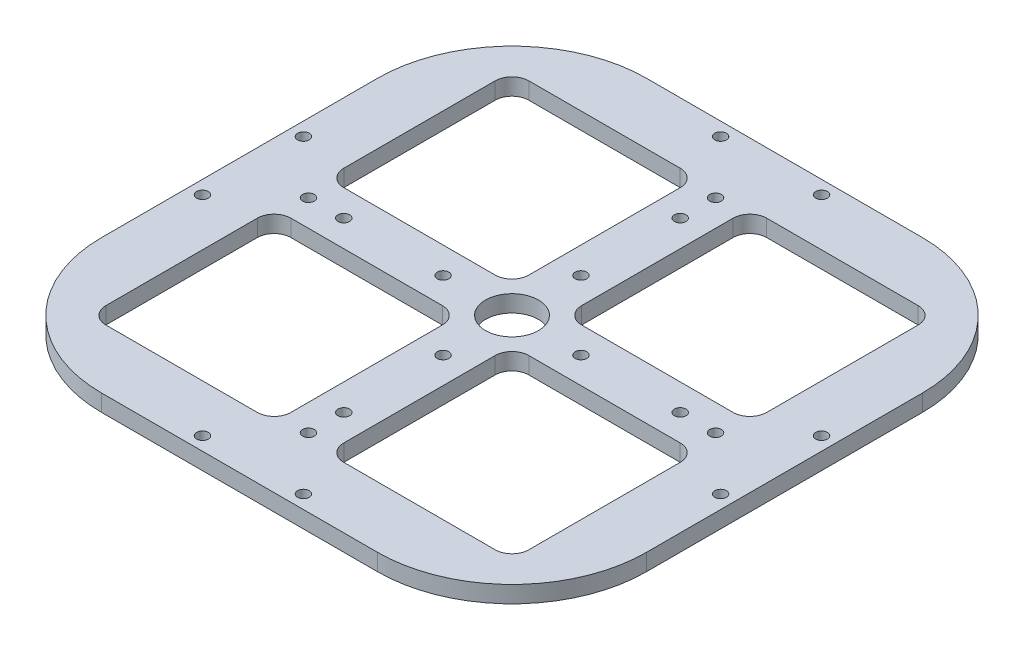
from build123d import *

# Parameters (mm, degrees)
SKETCH1_W                = 205.74
SKETCH1_H                = 205.74
SKETCH1_R                = 2.200000045
BOSS_EXTRUDE1_DEPTH      = 6.35
SKETCH3_R                = 9.999999939
CUT_EXTRUDE2_DEPTH       = 146.618667416
SKETCH4_W                = 69.85
SKETCH4_H                = 69.85
CUT_EXTRUDE3_DEPTH       = 146.618667416
FILLET1_R                = 6.35
CIRPATTERN2_COUNT        = 4
FILLET1_OF_CIRPATTERN2_R = 6.35
FILLET2_R                = 50.8
SKETCH10_R               = 2.200000045
CUT_EXTRUDE6_DEPTH       = 146.618667416
SKETCH11_R               = 4.000000001
CUT_EXTRUDE7_DEPTH       = 3.000000096
CIRPATTERN4_COUNT        = 4


with BuildPart() as part:
    # Sketch1 → Boss-Extrude1 (new body)
    with BuildSketch(Plane(origin=(0, 0, 0), x_dir=(1, 0, 0), z_dir=(0, 1, 0))):
        Rectangle(SKETCH1_W, SKETCH1_H)
        with Locations(Location((63.5, 0, 0), (0, 0, 270))):
            Circle(SKETCH1_R, mode=Mode.SUBTRACT)
        with Locations(Location((0, -63.5, 0), (0, 0, 270))):
            Circle(SKETCH1_R, mode=Mode.SUBTRACT)
        with Locations(Location((-63.5, 0, 0), (0, 0, 270))):
            Circle(SKETCH1_R, mode=Mode.SUBTRACT)
        with Locations(Location((0, 63.5, 0), (0, 0, 270))):
            Circle(SKETCH1_R, mode=Mode.SUBTRACT)
    extrude(amount=BOSS_EXTRUDE1_DEPTH)

    # Sketch3 → Cut-Extrude2 (cut, through all)
    with BuildSketch(Plane(origin=(0, 6.35, 0), x_dir=(1, 0, 0), z_dir=(0, 1, 0))):
        with Locations(Location((0, 0, 0), (0, 0, 270))):
            Circle(SKETCH3_R)
    extrude(amount=-CUT_EXTRUDE2_DEPTH, mode=Mode.SUBTRACT)

    # Sketch4 → Cut-Extrude3 (cut, through all)
    with BuildSketch(Plane(origin=(0, 6.35, 0), x_dir=(1, 0, 0), z_dir=(0, 1, 0))):
        with Locations((-44.901280605, 44.901280605)):
            Rectangle(SKETCH4_W, SKETCH4_H)
    cut_extrude3 = extrude(amount=-CUT_EXTRUDE3_DEPTH, mode=Mode.SUBTRACT)

    # Fillet1
    fillet1_edges = [part.edges().sort_by_distance(p)[0] for p in [
        (-9.976280605, 3.175, -79.826280605),
        (-9.976280605, 3.175, -9.976280605),
        (-79.826280605, 3.175, -9.976280605),
        (-79.826280605, 3.175, -79.826280605),
    ]]
    fillet(fillet1_edges, radius=FILLET1_R)

    # CirPattern2: Cut-Extrude3 ×4 about axis
    cirpattern2_axis = Axis((0, 0, 0), (0, 1, 0))
    for i in range(1, CIRPATTERN2_COUNT):
        add(cut_extrude3.rotate(cirpattern2_axis, i * 360 / CIRPATTERN2_COUNT), mode=Mode.SUBTRACT)

    # Fillet1 of CirPattern2
    fillet1_of_cirpattern2_edges = [part.edges().sort_by_distance(p)[0] for p in [
        (-79.826280605, 3.175, 9.976280605),
        (-9.976280605, 3.175, 9.976280605),
        (-9.976280605, 3.175, 79.826280605),
        (-79.826280605, 3.175, 79.826280605),
        (9.976280605, 3.175, 79.826280605),
        (9.976280605, 3.175, 9.976280605),
        (79.826280605, 3.175, 9.976280605),
        (79.826280605, 3.175, 79.826280605),
        (79.826280605, 3.175, -9.976280605),
        (9.976280605, 3.175, -9.976280605),
        (9.976280605, 3.175, -79.826280605),
        (79.826280605, 3.175, -79.826280605),
    ]]
    fillet(fillet1_of_cirpattern2_edges, radius=FILLET1_OF_CIRPATTERN2_R)

    # Fillet2
    fillet2_edges = [part.edges().sort_by_distance(p)[0] for p in [
        (102.87, 3.175, 102.87),
        (-102.87, 3.175, 102.87),
        (-102.87, 3.175, -102.87),
        (102.87, 3.175, -102.87),
    ]]
    fillet(fillet2_edges, radius=FILLET2_R)

    # Sketch10 → Cut-Extrude6 (cut, through all)
    with BuildSketch(Plane(origin=(0, 6.35, 0), x_dir=(1, 0, 0), z_dir=(0, 1, 0))):
        with Locations(Location((0, -26.035, 0), (0, 0, 270))):
            Circle(SKETCH10_R)
        with Locations(Location((0, -76.835, 0), (0, 0, 270))):
            Circle(SKETCH10_R)
        with Locations(Location((-19.05, -97.79, 0), (0, 0, 270))):
            Circle(SKETCH10_R)
        with Locations(Location((19.05, -97.79, 0), (0, 0, 270))):
            Circle(SKETCH10_R)
    cut_extrude6 = extrude(amount=-CUT_EXTRUDE6_DEPTH, mode=Mode.SUBTRACT)

    # Sketch11 → Cut-Extrude7 (cut)
    with BuildSketch(Plane.XZ):
        with Locations(Location((-19.05, 97.79, 0), (0, 0, 270))):
            Circle(SKETCH11_R)
        with Locations(Location((19.05, 97.79, 0), (0, 0, 270))):
            Circle(SKETCH11_R)
        with Locations(Location((0, 76.835, 0), (0, 0, 270))):
            Circle(SKETCH11_R)
        with Locations(Location((0, 26.035, 0), (0, 0, 270))):
            Circle(SKETCH11_R)
    cut_extrude7 = extrude(amount=-CUT_EXTRUDE7_DEPTH, mode=Mode.SUBTRACT)

    # CirPattern4: Cut-Extrude6, Cut-Extrude7 ×4 about axis
    cirpattern4_axis = Axis((0, 0, 0), (0, 1, 0))
    add([cut_extrude6.rotate(cirpattern4_axis, i * 360 / CIRPATTERN4_COUNT) for i in range(1, CIRPATTERN4_COUNT)], mode=Mode.SUBTRACT)
    add([cut_extrude7.rotate(cirpattern4_axis, i * 360 / CIRPATTERN4_COUNT) for i in range(1, CIRPATTERN4_COUNT)], mode=Mode.SUBTRACT)


solid = part.part
